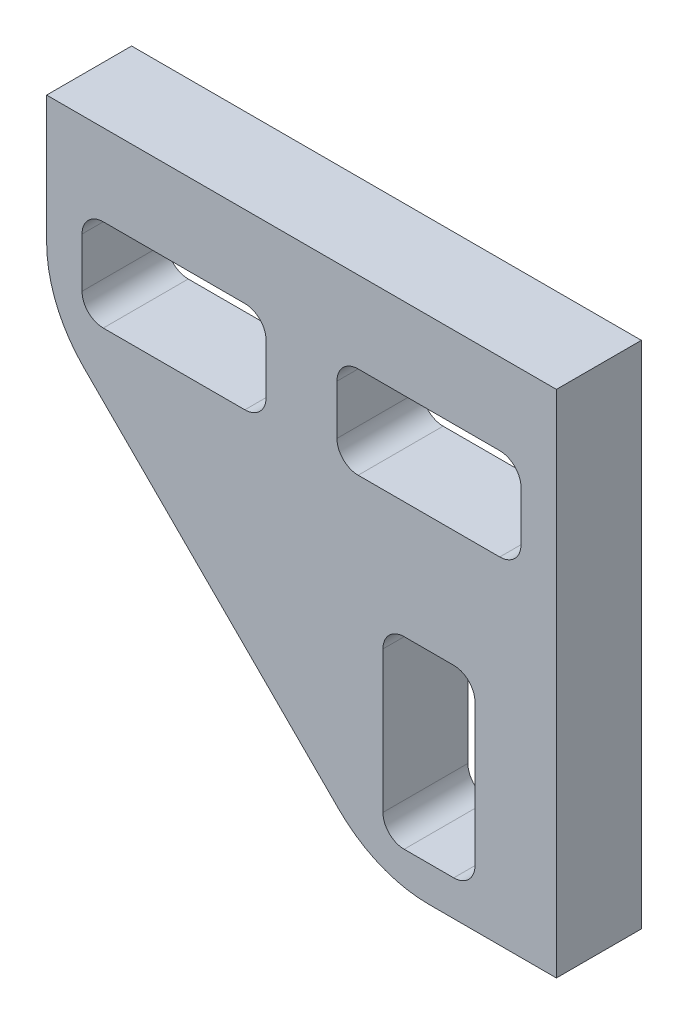
from build123d import *

# Parameters (mm, degrees)
SALIENTE_EXTRUIR1_DEPTH = 3


with BuildPart() as part:
    # Model → Saliente-Extruir1 (new body)
    with BuildSketch(Plane.XY):
        with BuildLine():
            Line((149.34213351, 211.823953209), (158.34213351, 211.823953209))
            Line((158.34213351, 211.823953209), (162.84213351, 211.823953209))
            Line((162.84213351, 211.823953209), (162.84213351, 198.323953209))
            Line((162.84213351, 198.323953209), (162.84213351, 193.823953209))
            Line((162.84213351, 193.823953209), (158.34213351, 193.823953209))
            ThreePointArc((158.34213351, 193.823953209), (156.620058064, 194.166495313), (155.160152994, 195.141972694))
            Line((155.160152994, 195.141972694), (146.160152994, 204.141972694))
            ThreePointArc((146.160152994, 204.141972694), (145.184675613, 205.601877763), (144.84213351, 207.323953209))
            Line((144.84213351, 207.323953209), (144.84213351, 211.823953209))
            Line((144.84213351, 211.823953209), (149.34213351, 211.823953209))
        make_face()
        with BuildLine():
            Line((156.71713351, 195.823953209), (156.71713351, 200.823953209))
            ThreePointArc((156.71713351, 200.823953209), (156.936803424, 201.354283295), (157.46713351, 201.573953209))
            Line((157.46713351, 201.573953209), (159.21713351, 201.573953209))
            ThreePointArc((159.21713351, 201.573953209), (159.747463595, 201.354283295), (159.96713351, 200.823953209))
            Line((159.96713351, 200.823953209), (159.96713351, 195.823953209))
            ThreePointArc((159.96713351, 195.823953209), (159.747463595, 195.293623123), (159.21713351, 195.073953209))
            Line((159.21713351, 195.073953209), (157.46713351, 195.073953209))
            ThreePointArc((157.46713351, 195.073953209), (156.936803424, 195.293623123), (156.71713351, 195.823953209))
        make_face(mode=Mode.SUBTRACT)
        with BuildLine():
            Line((151.84213351, 205.698953209), (146.84213351, 205.698953209))
            ThreePointArc((146.84213351, 205.698953209), (146.311803424, 205.918623123), (146.09213351, 206.448953209))
            Line((146.09213351, 206.448953209), (146.09213351, 208.198953209))
            ThreePointArc((146.09213351, 208.198953209), (146.311803424, 208.729283295), (146.84213351, 208.948953209))
            Line((146.84213351, 208.948953209), (151.84213351, 208.948953209))
            ThreePointArc((151.84213351, 208.948953209), (152.372463595, 208.729283295), (152.59213351, 208.198953209))
            Line((152.59213351, 208.198953209), (152.59213351, 206.448953209))
            ThreePointArc((152.59213351, 206.448953209), (152.372463595, 205.918623123), (151.84213351, 205.698953209))
        make_face(mode=Mode.SUBTRACT)
        with BuildLine():
            Line((160.84213351, 205.698953209), (155.84213351, 205.698953209))
            ThreePointArc((155.84213351, 205.698953209), (155.311803424, 205.918623123), (155.09213351, 206.448953209))
            Line((155.09213351, 206.448953209), (155.09213351, 208.198953209))
            ThreePointArc((155.09213351, 208.198953209), (155.311803424, 208.729283295), (155.84213351, 208.948953209))
            Line((155.84213351, 208.948953209), (160.84213351, 208.948953209))
            ThreePointArc((160.84213351, 208.948953209), (161.372463595, 208.729283295), (161.59213351, 208.198953209))
            Line((161.59213351, 208.198953209), (161.59213351, 206.448953209))
            ThreePointArc((161.59213351, 206.448953209), (161.372463595, 205.918623123), (160.84213351, 205.698953209))
        make_face(mode=Mode.SUBTRACT)
    extrude(amount=SALIENTE_EXTRUIR1_DEPTH)


solid = part.part
